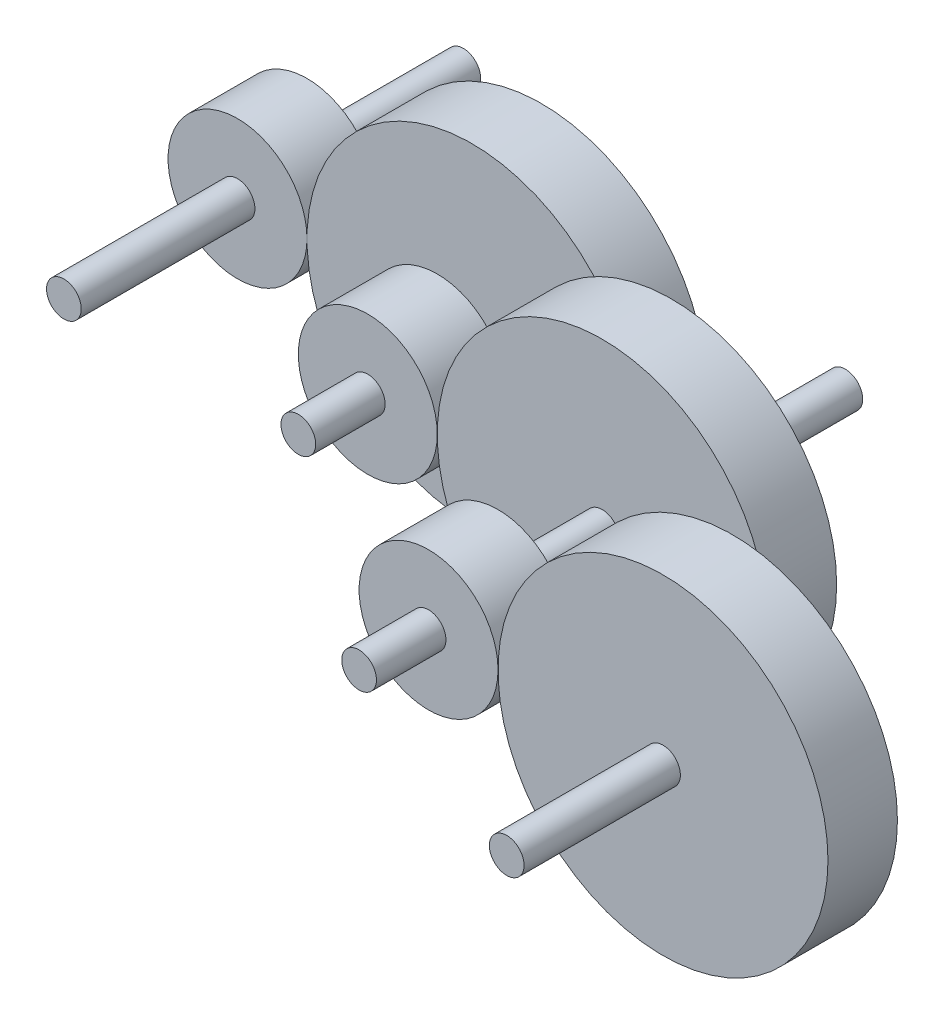
from build123d import *

# Parameters (mm, degrees)
SKETCH1_R             = 12.7
BOSS_EXTRUDE1_DEPTH   = 292.1
BOSS_EXTRUDE2_START   = 63.5
SKETCH1_3_R           = 12.7
BOSS_EXTRUDE2_DEPTH   = 228.6
BOSS_EXTRUDE3_START   = 63.5
SKETCH1_4_R           = 12.7
BOSS_EXTRUDE3_DEPTH   = 355.6
BOSS_EXTRUDE4_START   = 266.7
SKETCH1_5_R           = 12.7
BOSS_EXTRUDE4_DEPTH   = 215.9
BOSS_EXTRUDE5_START   = 114.3
SKETCH1_6_R           = 50.8
SKETCH1_6_R_2         = 12.7
BOSS_EXTRUDE5_DEPTH   = 50.8
SKETCH1_6_R_3         = 120.65
BOSS_EXTRUDE5_2_DEPTH = 50.8
BOSS_EXTRUDE7_START   = 190.5
SKETCH1_9_R           = 50.8
SKETCH1_9_R_2         = 120.65
BOSS_EXTRUDE7_DEPTH   = 50.8
BOSS_EXTRUDE8_START   = 317.5
SKETCH1_10_R          = 50.8
SKETCH1_10_R_2        = 120.65
BOSS_EXTRUDE8_DEPTH   = 50.8


with BuildPart() as part:
    # Sketch1 → Boss-Extrude1 (new body)
    with BuildSketch(Plane.XY):
        Circle(SKETCH1_R)
    extrude(amount=BOSS_EXTRUDE1_DEPTH)


with BuildPart() as body_2:
    # Sketch1<3> → Boss-Extrude2 (new body)
    with BuildSketch(Plane.XY.offset(BOSS_EXTRUDE2_START)):
        with Locations((171.45, 0)):
            Circle(SKETCH1_3_R)
    extrude(amount=BOSS_EXTRUDE2_DEPTH)



with BuildPart() as body_3:
    # Sketch1<4> → Boss-Extrude3 (new body)
    with BuildSketch(Plane.XY.offset(BOSS_EXTRUDE3_START)):
        with Locations((342.9, 0)):
            Circle(SKETCH1_4_R)
    extrude(amount=BOSS_EXTRUDE3_DEPTH)


with BuildPart() as body_4:
    # Sketch1<5> → Boss-Extrude4 (new body)
    with BuildSketch(Plane.XY.offset(BOSS_EXTRUDE4_START)):
        with Locations((514.35, 0)):
            Circle(SKETCH1_5_R)
    extrude(amount=BOSS_EXTRUDE4_DEPTH)


with BuildPart() as body_5:
    # Sketch1<6> → Boss-Extrude5 (new body)
    with BuildSketch(Plane.XY.offset(BOSS_EXTRUDE5_START)):
        Circle(SKETCH1_6_R)
        Circle(SKETCH1_6_R_2, mode=Mode.SUBTRACT)
    extrude(amount=BOSS_EXTRUDE5_DEPTH)


with BuildPart() as body_6:
    # Sketch1<6> → Boss-Extrude5 2 (new body)
    with BuildSketch(Plane.XY.offset(BOSS_EXTRUDE5_START)):
        with Locations((171.45, 0)):
            Circle(SKETCH1_6_R_3)
        with Locations((171.45, 0)):
            Circle(SKETCH1_6_R_2, mode=Mode.SUBTRACT)
    extrude(amount=BOSS_EXTRUDE5_2_DEPTH)


with BuildPart() as body_2_1:
    add(body_2.part)

    add(body_3.part)  # Boss-Extrude7 merges body 3
    # Sketch1<9> → Boss-Extrude7 (add)
    with BuildSketch(Plane.XY.offset(BOSS_EXTRUDE7_START)):
        with Locations((171.45, 0)):
            Circle(SKETCH1_9_R)
        with Locations((342.9, 0)):
            Circle(SKETCH1_9_R_2)
    extrude(amount=BOSS_EXTRUDE7_DEPTH)


    add(body_4.part)  # Boss-Extrude8 merges body 4
    # Sketch1<10> → Boss-Extrude8 (add)
    with BuildSketch(Plane.XY.offset(BOSS_EXTRUDE8_START)):
        with Locations((342.9, 0)):
            Circle(SKETCH1_10_R)
        with Locations((514.35, 0)):
            Circle(SKETCH1_10_R_2)
    extrude(amount=BOSS_EXTRUDE8_DEPTH)


solid = Compound([part.part, body_5.part, body_6.part, body_2_1.part])
